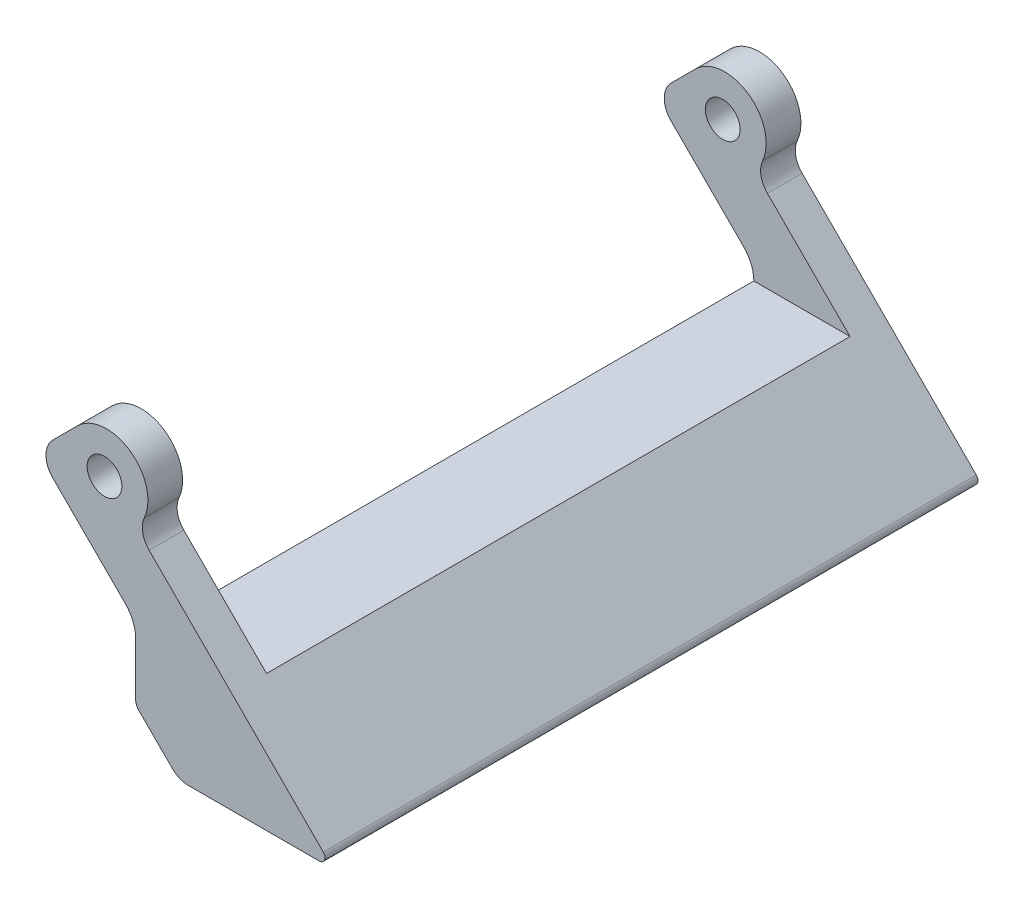
from build123d import *

# Parameters (mm, degrees)
SKETCH1_R           = 1.5
BOSS_EXTRUDE1_DEPTH = 3
BOSS_EXTRUDE2_DEPTH = 25.2
SKETCH6_W           = 57.536590271
SKETCH6_H           = 9.11547301
CUT_EXTRUDE1_DEPTH  = 64.271846515
FILLET1_R           = 2
FILLET2_R           = 1


with BuildPart() as part:
    # Sketch1 → Boss-Extrude1 (new body)
    with BuildSketch(Plane.XY):
        with BuildLine():
            Line((3.68220241, -19.5), (18.54616344, -19.5))
            ThreePointArc((18.54616344, -19.5), (19.008103207, -19.191341716), (18.899716831, -18.646446609))
            Line((18.899716831, -18.646446609), (3.854153503, -3.600883281))
            ThreePointArc((3.854153503, -3.600883281), (3.30197574, -2.551779506), (3.440748076, -1.374383543))
            ThreePointArc((3.440748076, -1.374383543), (2.199066013, 3.02009221), (-2.348238623, 2.601508845))
            Line((-2.348238623, 2.601508845), (-4.469558967, 0.480188501))
            ThreePointArc((-4.469558967, 0.480188501), (-5.055345405, -0.934025061), (-4.469558967, -2.348238623))
            Line((-4.469558967, -2.348238623), (1.803522753, -8.621320344))
            ThreePointArc((1.803522753, -8.621320344), (2.453841007, -9.59459039), (2.68220241, -10.742640687))
            Line((2.68220241, -10.742640687), (2.68220241, -18.5))
            ThreePointArc((2.68220241, -18.5), (2.975095629, -19.207106781), (3.68220241, -19.5))
        make_face()
        Circle(SKETCH1_R, mode=Mode.SUBTRACT)
    boss_extrude1 = extrude(amount=BOSS_EXTRUDE1_DEPTH)

    # Sketch2 → Boss-Extrude2 (add)
    with BuildSketch(Plane.XY.offset(3)):
        with BuildLine():
            Line((18.899716831, -18.646446609), (10.995910909, -10.742640687))
            Line((10.995910909, -10.742640687), (2.68220241, -10.742640687))
            Line((2.68220241, -10.742640687), (2.68220241, -18.5))
            ThreePointArc((2.68220241, -18.5), (2.975095629, -19.207106781), (3.68220241, -19.5))
            Line((3.68220241, -19.5), (18.54616344, -19.5))
            ThreePointArc((18.54616344, -19.5), (19.008103207, -19.191341716), (18.899716831, -18.646446609))
        make_face()
    boss_extrude2 = extrude(amount=BOSS_EXTRUDE2_DEPTH)

    # Mirror1: Boss-Extrude1, Boss-Extrude2 across plane
    add(boss_extrude1.mirror(Plane.XY.offset(28.2)))
    add(boss_extrude2.mirror(Plane.XY.offset(28.2)))

    # Sketch6 → Cut-Extrude1 (cut, through all)
    with BuildSketch(Plane(origin=(-6.530219139, -6.530219139, 0), x_dir=(0, 0, 1), z_dir=(-0.7071067811865487, -0.7071067811865465, 0))):
        with Locations((27.631704865, -17.586068001)):
            Rectangle(SKETCH6_W, SKETCH6_H)
    extrude(amount=CUT_EXTRUDE1_DEPTH, mode=Mode.SUBTRACT)

    # Fillet1
    fillet1_edges = [part.edges().sort_by_distance(p)[0] for p in [
        (6.439561723, -19.5, 28.2),
    ]]
    fillet(fillet1_edges, radius=FILLET1_R)

    # Fillet2
    fillet2_edges = [part.edges().sort_by_distance(p)[0] for p in [
        (2.68220241, -15.742640687, 28.2),
    ]]
    fillet(fillet2_edges, radius=FILLET2_R)


solid = part.part
